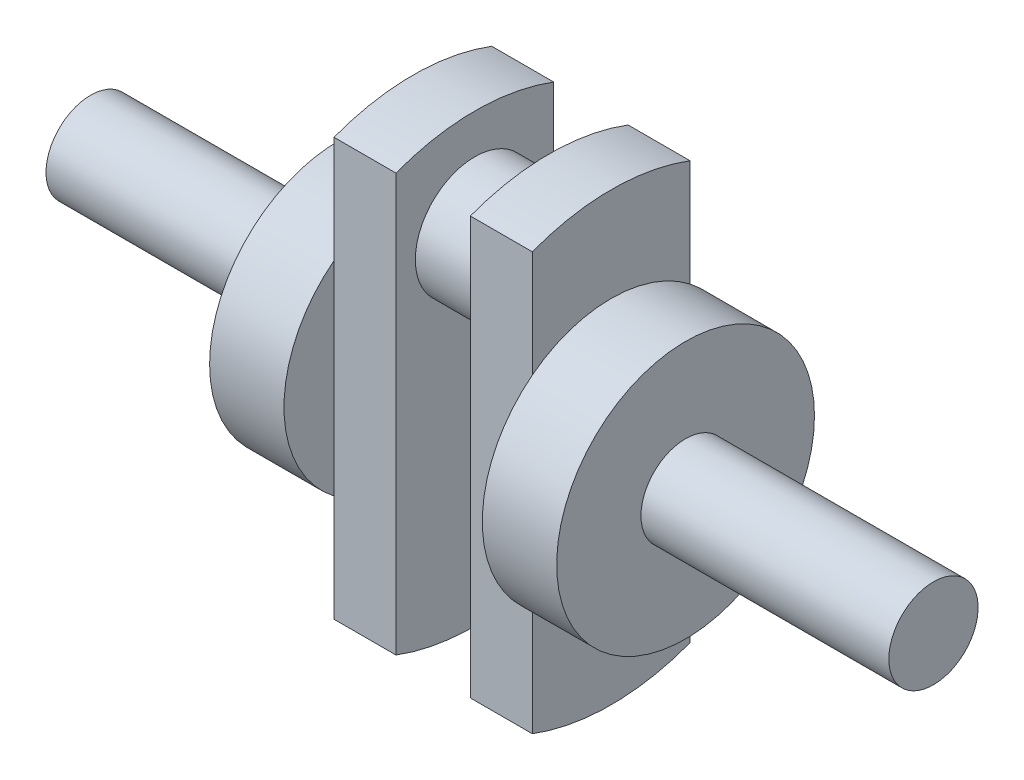
from build123d import *

# Parameters (mm, degrees)
BOSS_EXTRUDE1_DEPTH      = 40
BOSS_EXTRUDE2_DEPTH      = 65
BOSS_EXTRUDE2_DEPTH_BACK = 105
SKETCH2_R                = 9
SKETCH3_W                = 15
SKETCH3_H                = 130
CUT_EXTRUDE1_DEPTH       = 31.813269935
SKETCH4_R                = 12
BOSS_EXTRUDE3_DEPTH      = 40
SKETCH5_R                = 26
BOSS_EXTRUDE4_DEPTH      = 15
SKETCH6_R                = 26
BOSS_EXTRUDE5_DEPTH      = 15


with BuildPart() as part:
    # Sketch1 → Boss-Extrude1 (new body)
    with BuildSketch(Plane(origin=(0, 0, 0), x_dir=(0, 0, -1), z_dir=(1, 0, 0))):
        with BuildLine():
            Line((-15.906634967, -42.094880497), (-15.906634967, 42.094880497))
            ThreePointArc((-15.906634967, 42.094880497), (0, 45), (15.906634967, 42.094880497))
            Line((15.906634967, 42.094880497), (15.906634967, -42.094880497))
            ThreePointArc((15.906634967, -42.094880497), (0, -45), (-15.906634967, -42.094880497))
        make_face()
    extrude(amount=BOSS_EXTRUDE1_DEPTH)

    # Sketch2 → Boss-Extrude2 (add, two sides: drawn at the far end of the back side and taken through both)
    with BuildSketch(Plane.ZY.offset(-BOSS_EXTRUDE2_DEPTH_BACK)):
        Circle(SKETCH2_R)
    extrude(amount=BOSS_EXTRUDE2_DEPTH + BOSS_EXTRUDE2_DEPTH_BACK)

    # Sketch3 → Cut-Extrude1 (cut)
    with BuildSketch(Plane.XY.offset(15.906634967)):
        with Locations((20, 0.729141458)):
            Rectangle(SKETCH3_W, SKETCH3_H)
    extrude(amount=-CUT_EXTRUDE1_DEPTH, mode=Mode.SUBTRACT)


with BuildPart() as cut_extrude1_piece_1:
    # of the separate pieces the step leaves, piece 1, a body of its own (cut_extrude1_pieces)
    add(part.part.solids().sort_by_distance((0, -42.094880497, -15.906634967))[0])



with BuildPart() as cut_extrude1_piece_2:
    # of the separate pieces the step leaves, piece 2, a body of its own (cut_extrude1_pieces)
    add(part.part.solids().sort_by_distance((27.5, -42.094880497, -15.906634968))[0])


with BuildPart() as cut_extrude1_piece_1_1:
    add(cut_extrude1_piece_1.part)

    add(cut_extrude1_piece_2.part)  # Boss-Extrude3 merges Cut-Extrude1 piece 2
    # Sketch4 → Boss-Extrude3 (add)
    with BuildSketch(Plane(origin=(40, 0, 0), x_dir=(0, 0, -1), z_dir=(1, 0, 0))):
        with Locations(Location((0, 25, 0), (0, 0, 90))):
            Circle(SKETCH4_R)
    extrude(amount=-BOSS_EXTRUDE3_DEPTH)

    # Sketch5 → Boss-Extrude4 (add)
    with BuildSketch(Plane.ZY):
        with Locations(Location((0, 0, 0), (0, 0, 127.719309026))):
            Circle(SKETCH5_R)
    extrude(amount=BOSS_EXTRUDE4_DEPTH)

    # Sketch6 → Boss-Extrude5 (add)
    with BuildSketch(Plane(origin=(40, 0, 0), x_dir=(0, 0, -1), z_dir=(1, 0, 0))):
        with Locations(Location((0, 0, 0), (0, 0, 52.280690974))):
            Circle(SKETCH6_R)
    extrude(amount=BOSS_EXTRUDE5_DEPTH)


solid = cut_extrude1_piece_1_1.part
